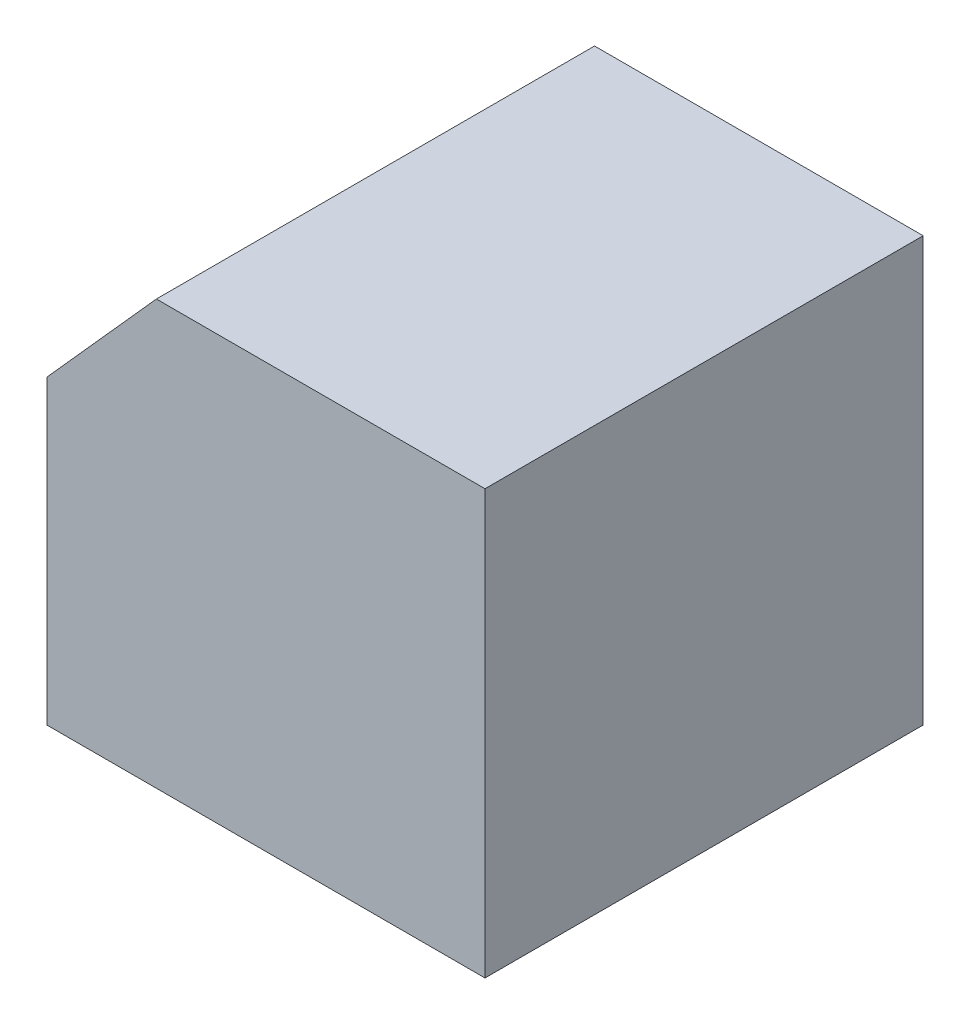
from build123d import *

# Parameters (mm, degrees)
BOSS_EXTRUDE1_DEPTH = 406.4


with BuildPart() as part:
    # Sketch1 → Boss-Extrude1 (new body)
    with BuildSketch(Plane.XY):
        Polygon((0, 279.4), (0, 0), (406.4, 0), (406.4, 392.992253257), (101.6, 392.992253257), align=None)
    extrude(amount=BOSS_EXTRUDE1_DEPTH)


solid = part.part
